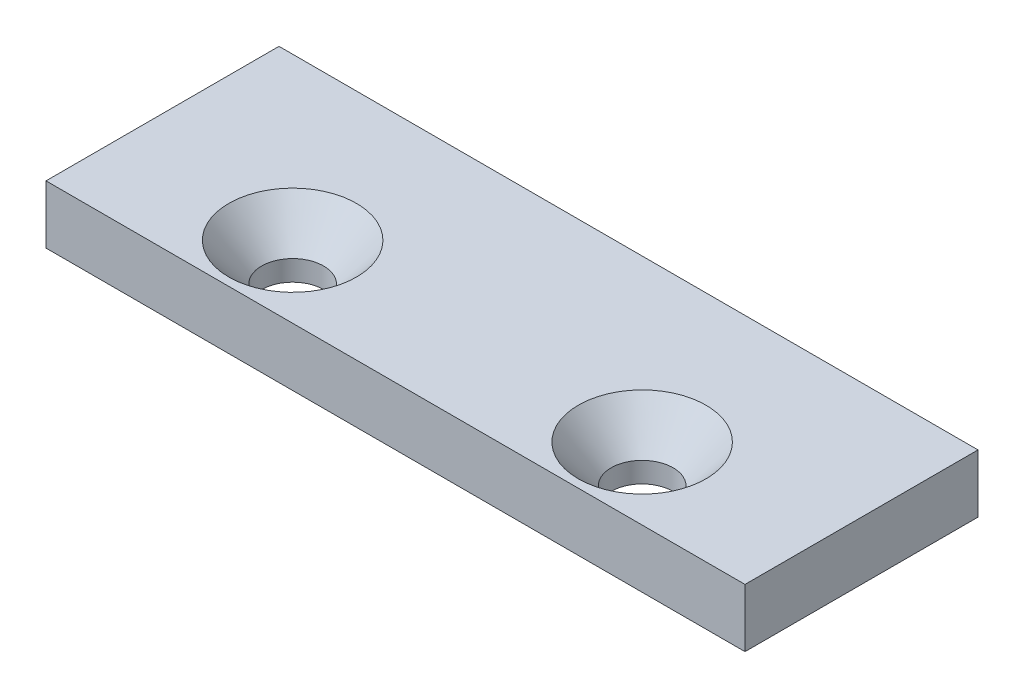
from build123d import *

# Parameters (mm, degrees)
SKETCH1_W                                     = 76.2
SKETCH1_H                                     = 25.4
BOSS_EXTRUDE1_DEPTH                           = 6.35
CSK_FOR_1_4_FLAT_HEAD_MACHINE_SCREW1_AT_COUNT = 2
CSK_FOR_1_4_FLAT_HEAD_MACHINE_SCREW1_AT_PITCH = 38.1


with BuildPart() as part:
    # Sketch1 → Boss-Extrude1 (new body)
    with BuildSketch(Plane(origin=(0, 0, 0), x_dir=(1, 0, 0), z_dir=(0, 1, 0))):
        with Locations((38.1, 12.7)):
            Rectangle(SKETCH1_W, SKETCH1_H)
    extrude(amount=-BOSS_EXTRUDE1_DEPTH)

    # Sketch3 → CSK for 1/4 Flat Head Machine Screw1 (revolve, cut)
    with BuildSketch(Plane(origin=(19.05, 0, -7.839304919), x_dir=(0, 0, 1), z_dir=(1, 0, 0))):
        Polygon((0, 0), (0, 6.35), (3.3782, 6.35), (3.3782, 4.119929414), (6.9596, 0), align=None)
    csk_for_1_4_flat_head_machine_screw1 = revolve(axis=Axis((19.05, 6.35, -7.839304919), (0, -1, 0)), mode=Mode.SUBTRACT)

    # CSK for 1/4 Flat Head Machine Screw1 at: CSK for 1/4 Flat Head Machine Screw1 ×2
    with Locations(*[(i * CSK_FOR_1_4_FLAT_HEAD_MACHINE_SCREW1_AT_PITCH, 0, 0) for i in range(1, CSK_FOR_1_4_FLAT_HEAD_MACHINE_SCREW1_AT_COUNT)]):
        add(csk_for_1_4_flat_head_machine_screw1, mode=Mode.SUBTRACT)


solid = part.part
